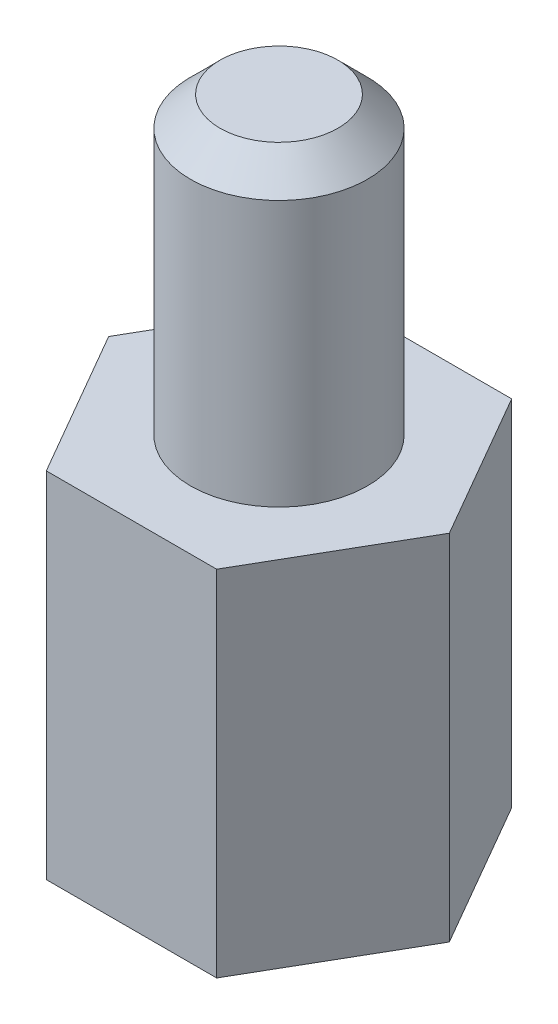
from build123d import *

# Parameters (mm, degrees)
EXTRUDE_1_DEPTH           = 6
HOLE_WIZARD_3_0_3_1_D     = 3
HOLE_WIZARD_3_0_3_1_DEPTH = 5.5
HOLE_WIZARD_3_0_3_1_TIP   = 0.901290929
EXTRUDE_START             = 5
SKETCH_4_R                = 1.5
EXTRUDE_2_DEPTH           = 5
CHAMFER_1_SIZE            = 0.5


with BuildPart() as part:
    # Эскиз1 → Бобышка-Вытянуть1 (new body)
    with BuildSketch(Plane(origin=(0, 0, 0), x_dir=(1, 0, 0), z_dir=(0, 1, 0))):
        Polygon((1.443375673, -2.5), (2.886751346, 0), (1.443375673, 2.5), (-1.443375673, 2.5), (-2.886751346, 0), (-1.443375673, -2.5), align=None)
    extrude(amount=EXTRUDE_1_DEPTH)

    # Диаметр отверстия Ø3.0 (3)1
    with Locations(Plane(origin=(0, 0, 0), x_dir=(-1, 0, 0), z_dir=(0, -1, 0))):
        with Locations((0, 0)):
            Hole(HOLE_WIZARD_3_0_3_1_D / 2, depth=HOLE_WIZARD_3_0_3_1_DEPTH)
            with Locations((0, 0, -(HOLE_WIZARD_3_0_3_1_DEPTH + HOLE_WIZARD_3_0_3_1_TIP / 2))):  # 118° drill point
                Cone(0, HOLE_WIZARD_3_0_3_1_D / 2, HOLE_WIZARD_3_0_3_1_TIP, mode=Mode.SUBTRACT)

    # Эскиз4 → Бобышка-Вытянуть2 (add)
    with BuildSketch(Plane(origin=(0, 6, 0), x_dir=(1, 0, 0), z_dir=(0, 1, 0)).offset(EXTRUDE_START)):
        with Locations(Location((0, 0, 0), (0, 0, 90))):
            Circle(SKETCH_4_R)
    extrude(amount=-EXTRUDE_2_DEPTH)

    # Фаска1
    chamfer_1_edges = [part.edges().sort_by_distance(p)[0] for p in [
        (-1.5, 0, 0),
        (0, 11, 1.5),
    ]]
    chamfer(chamfer_1_edges, length=CHAMFER_1_SIZE)


solid = part.part
